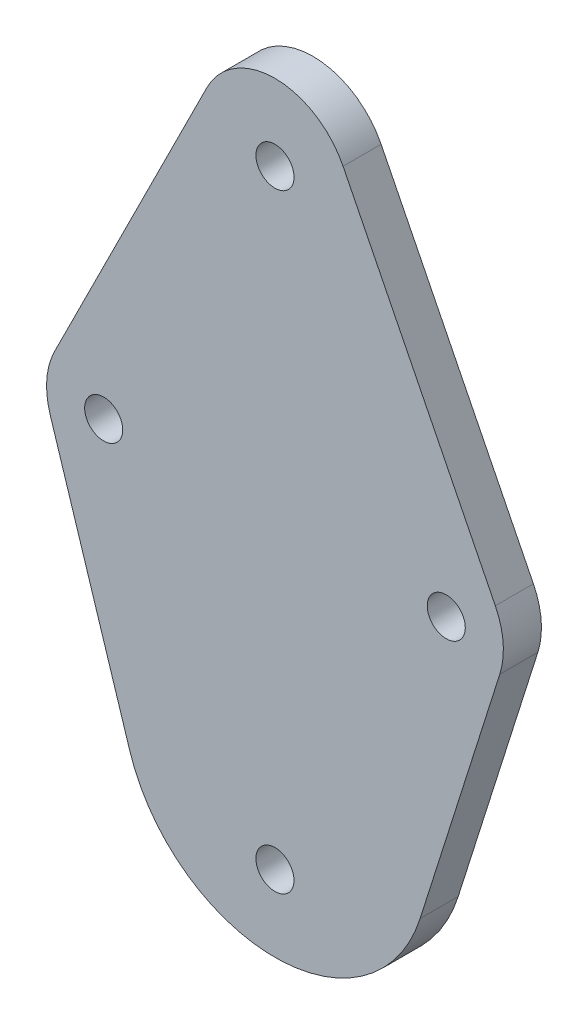
from build123d import *

# Parameters (mm, degrees)
BOSS_EXTRUDE1_DEPTH = 5
SKETCH2_R           = 2.5
CUT_EXTRUDE1_DEPTH  = 59.523499554


with BuildPart() as part:
    # Sketch1 → Boss-Extrude1 (new body)
    with BuildSketch(Plane.XY):
        with BuildLine():
            Line((28.94427191, 4.472135955), (8.94427191, 44.472135955))
            ThreePointArc((8.94427191, 44.472135955), (0, 50), (-8.94427191, 44.472135955))
            Line((-8.94427191, 44.472135955), (-28.94427191, 4.472135955))
            ThreePointArc((-28.94427191, 4.472135955), (-29.969329949, 0.782598474), (-29.532542189, -3.021694793))
            Line((-29.532542189, -3.021694793), (-19.065084378, -36.043389585))
            ThreePointArc((-19.065084378, -36.043389585), (0, -50), (19.065084378, -36.043389585))
            Line((19.065084378, -36.043389585), (29.532542189, -3.021694793))
            ThreePointArc((29.532542189, -3.021694793), (29.969329949, 0.782598474), (28.94427191, 4.472135955))
        make_face()
    extrude(amount=BOSS_EXTRUDE1_DEPTH)

    # Sketch2 → Cut-Extrude1 (cut, through all)
    with BuildSketch(Plane.XY.offset(5)):
        with Locations((0, 40)):
            Circle(SKETCH2_R)
        with Locations((0, -40)):
            Circle(SKETCH2_R)
        with Locations((22.5, 0)):
            Circle(SKETCH2_R)
        with Locations((-22.5, 0)):
            Circle(SKETCH2_R)
    extrude(amount=-CUT_EXTRUDE1_DEPTH, mode=Mode.SUBTRACT)


solid = part.part
